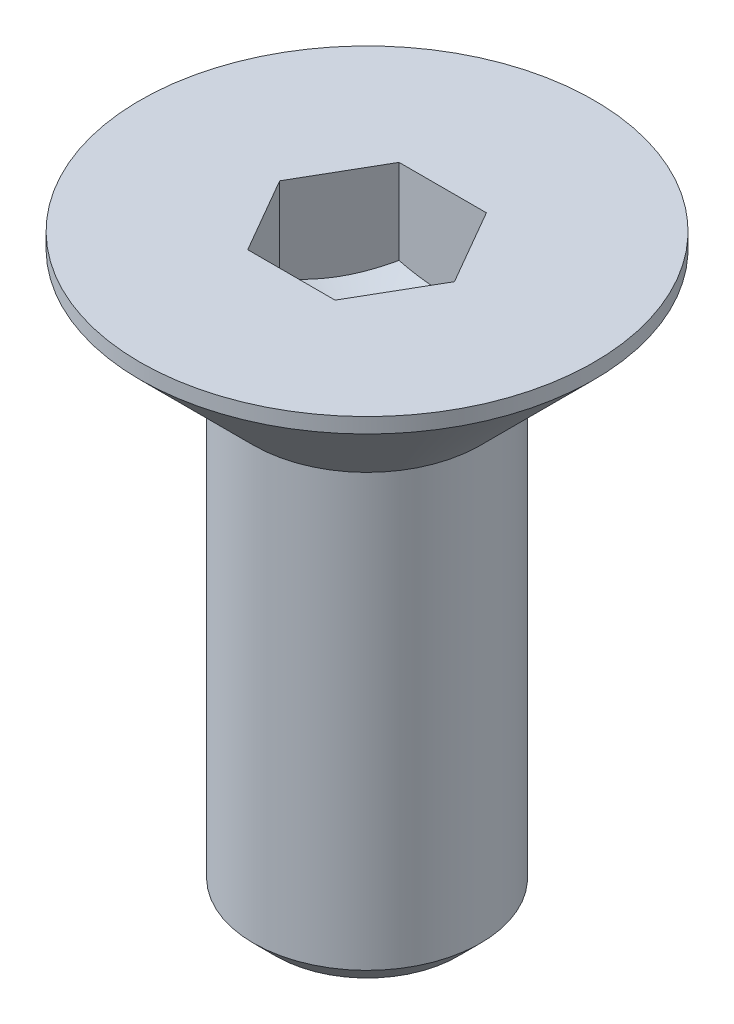
from build123d import *

# Parameters (mm, degrees)
CUT_EXTRUDE2_REACH = 10.791


with BuildPart() as part:
    # Sketch1 → Revolve1 (revolve)
    with BuildSketch(Plane.XY, mode=Mode.PRIVATE) as revolve1_sk:
        Polygon((-1.5, -1.7), (-1.5, -7.4), (-1.2, -7.7), (0, -7.7), (0, -1.7), (-1, -1.2), (-1, 0), (-3, 0), (-3, -0.2), align=None)
    revolve(revolve1_sk.sketch.rotate(Axis((0, 2.75, 0), (0, -1, 0)), 270), axis=Axis((0, 2.75, 0), (0, -1, 0)))

    # Cut-Extrude2: up to this cone (the profile starts inside it)
    cut_extrude2_end = Plane(origin=(0, 0, 0), z_dir=(0, 1, 0)).offset(-1.699999) * Cone(2e-06, 32.782, 16.390999, align=(Align.CENTER, Align.CENTER, Align.MIN), mode=Mode.PRIVATE)
    # Sketch3 → Cut-Extrude2 (cut, up to the surface)
    with BuildSketch(Plane(origin=(0, 0, 0), x_dir=(1, 0, 0), z_dir=(0, 1, 0)), mode=Mode.PRIVATE) as cut_extrude2_sk1:
        Polygon((-0.577350269, -1), (0.577350269, -1), (1.154700538, 0), (0.577350269, 1), (-0.577350269, 1), (-1.154700538, 0), align=None)
    cut_extrude2_tool1 = extrude(cut_extrude2_sk1.sketch, amount=-CUT_EXTRUDE2_REACH, mode=Mode.PRIVATE) & cut_extrude2_end
    add(cut_extrude2_tool1.solids().sort_by_distance((0, 0, 0))[0], mode=Mode.SUBTRACT)


solid = part.part
